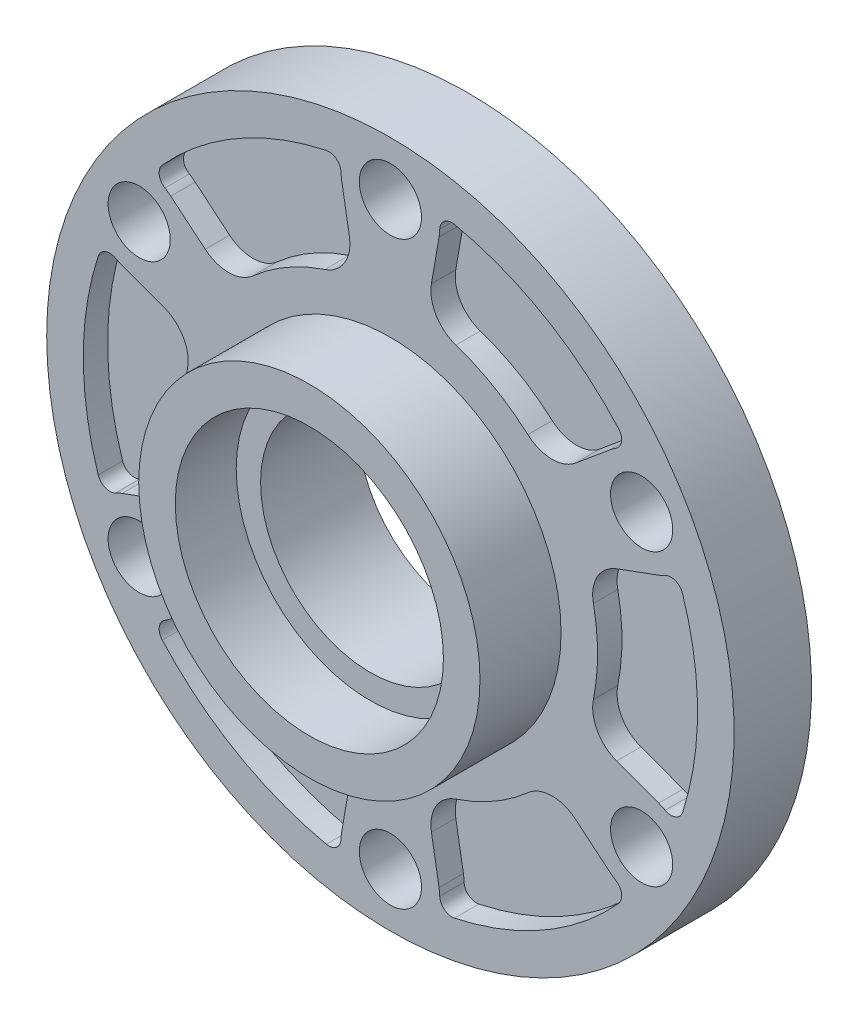
from build123d import *

# Parameters (mm, degrees)
ESQUISSE1_R                  = 28.2
ESQUISSE1_R_2                = 9
BOSS_EXTRU_1_DEPTH           = 13
ENL_V_START                  = -6.65
ESQUISSE2_R                  = 28.2
ESQUISSE2_R_2                = 14
ENL_V_MAT_EXTRU_1_DEPTH      = 6.65
ESQUISSE3_R                  = 2.55
ENL_V_MAT_EXTRU_2_DEPTH      = 41.431454339
R_P_TITION_CIRCULAIRE1_COUNT = 6
ENL_V_MAT_EXTRU_3_DEPTH      = 2
R_P_TITION_CIRCULAIRE2_COUNT = 6
SYM_TRIE1_COPY_1_DEPTH       = 2
SYM_TRIE1_COPY_2_DEPTH       = 2
SYM_TRIE1_COPY_3_DEPTH       = 2
SYM_TRIE1_COPY_4_DEPTH       = 2
SYM_TRIE1_COPY_5_DEPTH       = 2
ESQUISSE5_R                  = 11
ENL_V_MAT_EXTRU_4_DEPTH      = 5


with BuildPart() as part:
    # Esquisse1 → Boss.-Extru.1 (new body)
    with BuildSketch(Plane.XY):
        with Locations(Location((0, 0, 0), (0, 0, 180))):
            Circle(ESQUISSE1_R)
        with Locations(Location((0, 0, 0), (0, 0, 180))):
            Circle(ESQUISSE1_R_2, mode=Mode.SUBTRACT)
    extrude(amount=BOSS_EXTRU_1_DEPTH)

    # Esquisse2 → Enlèv. mat.-Extru.1 (cut)
    with BuildSketch(Plane.XY.offset(13).offset(ENL_V_START)):
        with Locations(Location((0, 0, 0), (0, 0, 180))):
            Circle(ESQUISSE2_R)
        Circle(ESQUISSE2_R_2, mode=Mode.SUBTRACT)
    extrude(amount=ENL_V_MAT_EXTRU_1_DEPTH, mode=Mode.SUBTRACT)

    # Esquisse3 → Enlèv. mat.-Extru.2 (cut, through all)
    with BuildSketch(Plane.XY.offset(6.35)):
        with Locations((0, 23.8)):
            Circle(ESQUISSE3_R)
    enl_v_mat_extru_2 = extrude(amount=-ENL_V_MAT_EXTRU_2_DEPTH, mode=Mode.SUBTRACT)

    # Répétition circulaire1: Enlèv. mat.-Extru.2 ×6 about axis
    r_p_tition_circulaire1_axis = Axis((0, 0, 0), (0, 0, 1))
    for i in range(1, R_P_TITION_CIRCULAIRE1_COUNT):
        add(enl_v_mat_extru_2.rotate(r_p_tition_circulaire1_axis, i * 360 / R_P_TITION_CIRCULAIRE1_COUNT), mode=Mode.SUBTRACT)

    # Esquisse4 → Enlèv. mat.-Extru.3 (cut)
    with BuildSketch(Plane.XY.offset(6.35)):
        with BuildLine():
            Line((-18.557211097, 6.82861013), (-22.010022125, 8.09916206))
            ThreePointArc((-22.010022125, 8.09916206), (-22.281258432, 8.21027261), (-22.543748209, 8.340709591))
            ThreePointArc((-22.543748209, 8.340709591), (-23.391776632, 8.39054265), (-23.972145709, 7.77021429))
            ThreePointArc((-23.972145709, 7.77021429), (-25.2, 0), (-23.972145709, -7.77021429))
            ThreePointArc((-23.972145709, -7.77021429), (-23.391776632, -8.39054265), (-22.543748209, -8.340709591))
            ThreePointArc((-22.543748209, -8.340709591), (-22.281258432, -8.21027261), (-22.010022125, -8.09916206))
            Line((-22.010022125, -8.09916206), (-18.557211097, -6.82861013))
            ThreePointArc((-18.557211097, -6.82861013), (-16.972188941, -5.472686472), (-16.65424046, -3.411198426))
            ThreePointArc((-16.65424046, -3.411198426), (-17, 0), (-16.65424046, 3.411198426))
            ThreePointArc((-16.65424046, 3.411198426), (-16.972188941, 5.472686472), (-18.557211097, 6.82861013))
        make_face()
    enl_v_mat_extru_3 = extrude(amount=-ENL_V_MAT_EXTRU_3_DEPTH, mode=Mode.SUBTRACT)

    # Répétition circulaire2: Enlèv. mat.-Extru.3 ×6 about axis
    r_p_tition_circulaire2_axis = Axis((0, 0, 0), (0, 0, 1))
    for i in range(1, R_P_TITION_CIRCULAIRE2_COUNT):
        add(enl_v_mat_extru_3.rotate(r_p_tition_circulaire2_axis, i * 360 / R_P_TITION_CIRCULAIRE2_COUNT), mode=Mode.SUBTRACT)

    # Symétrie1: Enlèv. mat.-Extru.3 across plane
    add(enl_v_mat_extru_3.mirror(Plane.XY.offset(3.175)), mode=Mode.SUBTRACT)

    # Symétrie1 copy 1 sketch → Symétrie1 copy 1 (cut)
    with BuildSketch(Plane(origin=(0, 0, 0), x_dir=(0.5000000000000001, 0.8660254037844386, 0), z_dir=(0, 0, -1))):
        with BuildLine():
            Line((-18.557211097, -6.82861013), (-22.010022125, -8.09916206))
            ThreePointArc((-22.010022125, -8.09916206), (-22.281258432, -8.21027261), (-22.543748209, -8.340709591))
            ThreePointArc((-22.543748209, -8.340709591), (-23.391776632, -8.39054265), (-23.972145709, -7.77021429))
            ThreePointArc((-23.972145709, -7.77021429), (-25.2, 0), (-23.972145709, 7.77021429))
            ThreePointArc((-23.972145709, 7.77021429), (-23.391776632, 8.39054265), (-22.543748209, 8.340709591))
            ThreePointArc((-22.543748209, 8.340709591), (-22.281258432, 8.21027261), (-22.010022125, 8.09916206))
            Line((-22.010022125, 8.09916206), (-18.557211097, 6.82861013))
            ThreePointArc((-18.557211097, 6.82861013), (-16.972188941, 5.472686472), (-16.65424046, 3.411198426))
            ThreePointArc((-16.65424046, 3.411198426), (-17, 0), (-16.65424046, -3.411198426))
            ThreePointArc((-16.65424046, -3.411198426), (-16.972188941, -5.472686472), (-18.557211097, -6.82861013))
        make_face()
    extrude(amount=-SYM_TRIE1_COPY_1_DEPTH, mode=Mode.SUBTRACT)

    # Symétrie1 copy 2 sketch → Symétrie1 copy 2 (cut)
    with BuildSketch(Plane(origin=(0, 0, 0), x_dir=(-0.4999999999999998, 0.8660254037844387, 0), z_dir=(0, 0, -1))):
        with BuildLine():
            Line((-18.557211097, -6.82861013), (-22.010022125, -8.09916206))
            ThreePointArc((-22.010022125, -8.09916206), (-22.281258432, -8.21027261), (-22.543748209, -8.340709591))
            ThreePointArc((-22.543748209, -8.340709591), (-23.391776632, -8.39054265), (-23.972145709, -7.77021429))
            ThreePointArc((-23.972145709, -7.77021429), (-25.2, 0), (-23.972145709, 7.77021429))
            ThreePointArc((-23.972145709, 7.77021429), (-23.391776632, 8.39054265), (-22.543748209, 8.340709591))
            ThreePointArc((-22.543748209, 8.340709591), (-22.281258432, 8.21027261), (-22.010022125, 8.09916206))
            Line((-22.010022125, 8.09916206), (-18.557211097, 6.82861013))
            ThreePointArc((-18.557211097, 6.82861013), (-16.972188941, 5.472686472), (-16.65424046, 3.411198426))
            ThreePointArc((-16.65424046, 3.411198426), (-17, 0), (-16.65424046, -3.411198426))
            ThreePointArc((-16.65424046, -3.411198426), (-16.972188941, -5.472686472), (-18.557211097, -6.82861013))
        make_face()
    extrude(amount=-SYM_TRIE1_COPY_2_DEPTH, mode=Mode.SUBTRACT)

    # Symétrie1 copy 3 sketch → Symétrie1 copy 3 (cut)
    with BuildSketch(Plane(origin=(0, 0, 0), x_dir=(-1, 0, 0), z_dir=(0, 0, -1))):
        with BuildLine():
            Line((-18.557211097, -6.82861013), (-22.010022125, -8.09916206))
            ThreePointArc((-22.010022125, -8.09916206), (-22.281258432, -8.21027261), (-22.543748209, -8.340709591))
            ThreePointArc((-22.543748209, -8.340709591), (-23.391776632, -8.39054265), (-23.972145709, -7.77021429))
            ThreePointArc((-23.972145709, -7.77021429), (-25.2, 0), (-23.972145709, 7.77021429))
            ThreePointArc((-23.972145709, 7.77021429), (-23.391776632, 8.39054265), (-22.543748209, 8.340709591))
            ThreePointArc((-22.543748209, 8.340709591), (-22.281258432, 8.21027261), (-22.010022125, 8.09916206))
            Line((-22.010022125, 8.09916206), (-18.557211097, 6.82861013))
            ThreePointArc((-18.557211097, 6.82861013), (-16.972188941, 5.472686472), (-16.65424046, 3.411198426))
            ThreePointArc((-16.65424046, 3.411198426), (-17, 0), (-16.65424046, -3.411198426))
            ThreePointArc((-16.65424046, -3.411198426), (-16.972188941, -5.472686472), (-18.557211097, -6.82861013))
        make_face()
    extrude(amount=-SYM_TRIE1_COPY_3_DEPTH, mode=Mode.SUBTRACT)

    # Symétrie1 copy 4 sketch → Symétrie1 copy 4 (cut)
    with BuildSketch(Plane(origin=(0, 0, 0), x_dir=(-0.5000000000000004, -0.8660254037844384, 0), z_dir=(0, 0, -1))):
        with BuildLine():
            Line((-18.557211097, -6.82861013), (-22.010022125, -8.09916206))
            ThreePointArc((-22.010022125, -8.09916206), (-22.281258432, -8.21027261), (-22.543748209, -8.340709591))
            ThreePointArc((-22.543748209, -8.340709591), (-23.391776632, -8.39054265), (-23.972145709, -7.77021429))
            ThreePointArc((-23.972145709, -7.77021429), (-25.2, 0), (-23.972145709, 7.77021429))
            ThreePointArc((-23.972145709, 7.77021429), (-23.391776632, 8.39054265), (-22.543748209, 8.340709591))
            ThreePointArc((-22.543748209, 8.340709591), (-22.281258432, 8.21027261), (-22.010022125, 8.09916206))
            Line((-22.010022125, 8.09916206), (-18.557211097, 6.82861013))
            ThreePointArc((-18.557211097, 6.82861013), (-16.972188941, 5.472686472), (-16.65424046, 3.411198426))
            ThreePointArc((-16.65424046, 3.411198426), (-17, 0), (-16.65424046, -3.411198426))
            ThreePointArc((-16.65424046, -3.411198426), (-16.972188941, -5.472686472), (-18.557211097, -6.82861013))
        make_face()
    extrude(amount=-SYM_TRIE1_COPY_4_DEPTH, mode=Mode.SUBTRACT)

    # Symétrie1 copy 5 sketch → Symétrie1 copy 5 (cut)
    with BuildSketch(Plane(origin=(0, 0, 0), x_dir=(0.5000000000000001, -0.8660254037844386, 0), z_dir=(0, 0, -1))):
        with BuildLine():
            Line((-18.557211097, -6.82861013), (-22.010022125, -8.09916206))
            ThreePointArc((-22.010022125, -8.09916206), (-22.281258432, -8.21027261), (-22.543748209, -8.340709591))
            ThreePointArc((-22.543748209, -8.340709591), (-23.391776632, -8.39054265), (-23.972145709, -7.77021429))
            ThreePointArc((-23.972145709, -7.77021429), (-25.2, 0), (-23.972145709, 7.77021429))
            ThreePointArc((-23.972145709, 7.77021429), (-23.391776632, 8.39054265), (-22.543748209, 8.340709591))
            ThreePointArc((-22.543748209, 8.340709591), (-22.281258432, 8.21027261), (-22.010022125, 8.09916206))
            Line((-22.010022125, 8.09916206), (-18.557211097, 6.82861013))
            ThreePointArc((-18.557211097, 6.82861013), (-16.972188941, 5.472686472), (-16.65424046, 3.411198426))
            ThreePointArc((-16.65424046, 3.411198426), (-17, 0), (-16.65424046, -3.411198426))
            ThreePointArc((-16.65424046, -3.411198426), (-16.972188941, -5.472686472), (-18.557211097, -6.82861013))
        make_face()
    extrude(amount=-SYM_TRIE1_COPY_5_DEPTH, mode=Mode.SUBTRACT)

    # Esquisse5 → Enlèv. mat.-Extru.4 (cut)
    with BuildSketch(Plane.XY.offset(13)):
        Circle(ESQUISSE5_R)
    extrude(amount=-ENL_V_MAT_EXTRU_4_DEPTH, mode=Mode.SUBTRACT)


solid = part.part
